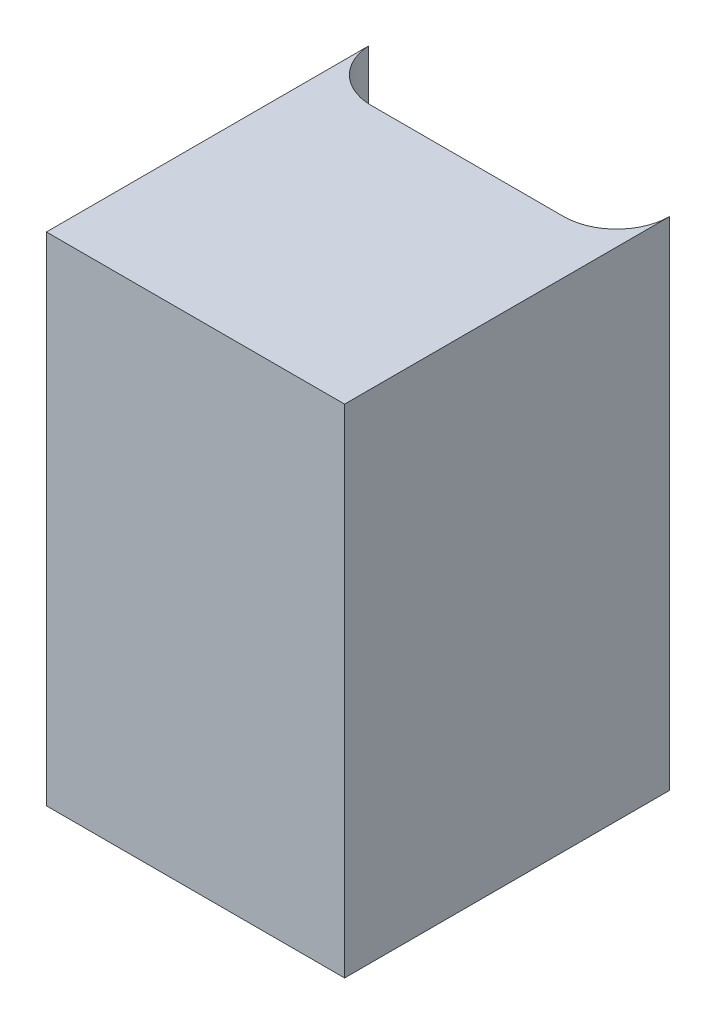
from build123d import *

# Parameters (mm, degrees)
SKETCH_1_W          = 20
SKETCH_1_H          = 30
EXTRUDE_1_DEPTH     = 18
CUT_EXTRUDE_4_DEPTH = 41.298883359


with BuildPart() as part:
    # Эскиз1 → Вытянуть1 (new body)
    with BuildSketch(Plane(origin=(0, 0, 0), x_dir=(0, 0, -1), z_dir=(1, 0, 0))):
        with Locations((-10, -6.749432462)):
            Rectangle(SKETCH_1_W, SKETCH_1_H)
    extrude(amount=EXTRUDE_1_DEPTH)

    # Эскиз2 → Вырез-Вытянуть4 (cut, through all)
    with BuildSketch(Plane(origin=(0, 8.250567538, 0), x_dir=(1, 0, 0), z_dir=(0, 1, 0))):
        with BuildLine():
            Line((-0.004897471, 0.146832679), (18, 0.146832679))
            Line((18, 0.146832679), (18, -0.382236535))
            ThreePointArc((18, -0.382236535), (17.0627417, -2.644978234), (14.8, -3.582236535))
            Line((14.8, -3.582236535), (3.195102529, -3.582236535))
            ThreePointArc((3.195102529, -3.582236535), (0.932360829, -2.644978234), (-0.004897471, -0.382236535))
            Line((-0.004897471, -0.382236535), (-0.004897471, 0.146832679))
        make_face()
    extrude(amount=-CUT_EXTRUDE_4_DEPTH, mode=Mode.SUBTRACT)


solid = part.part
